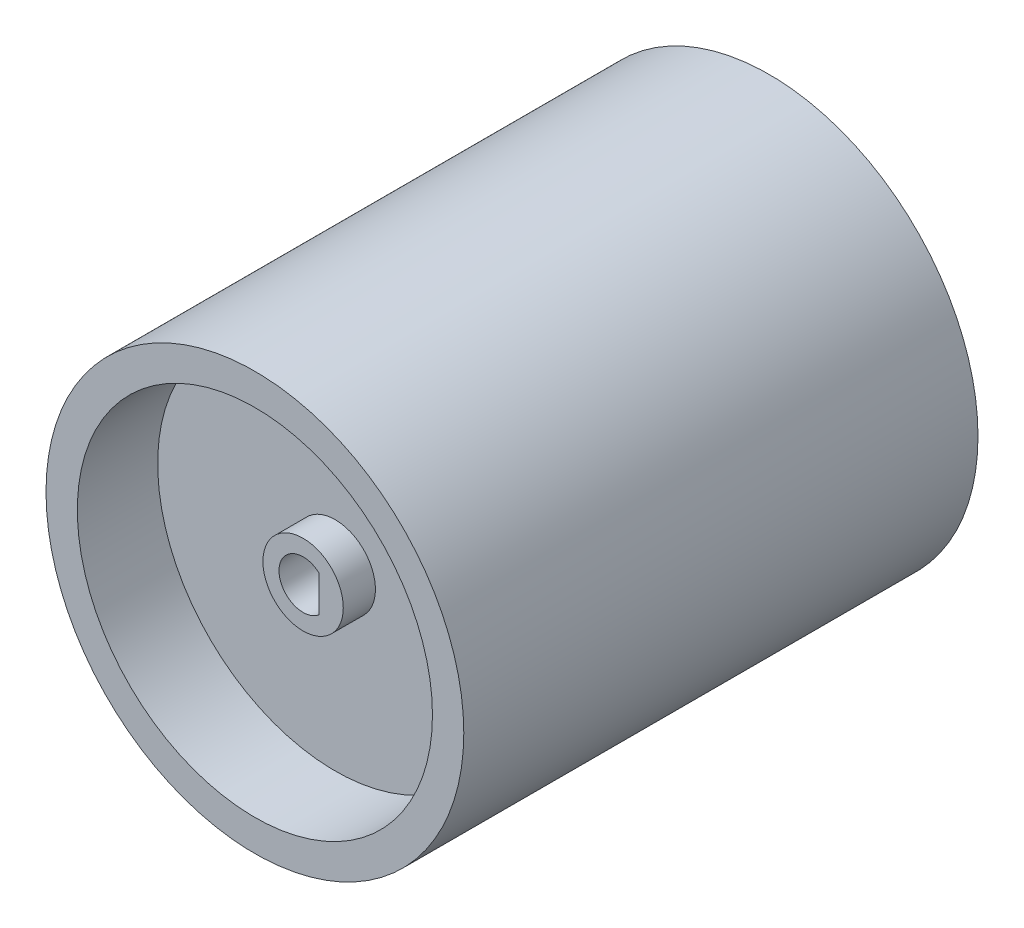
from build123d import *

# Parameters (mm, degrees)
SKETCH_1_R          = 13
SKETCH_1_R_2        = 11
EXTRUDE_1_DEPTH     = 7
SKETCH_3_R          = 13
EXTRUDE_2_DEPTH     = 2
CUT_EXTRUDE_1_REACH = 21.672
SKETCH_7_R          = 2.5
EXTRUDE_3_DEPTH     = 2
EXTRUDE_START       = 27
SKETCH_8_R          = 13
SKETCH_8_R_2        = 11
EXTRUDE_4_DEPTH     = 27
SKETCH_10_R         = 11.05
CUT_EXTRUDE_2_DEPTH = 27
CUT_EXTRUDE_START   = -5
SKETCH_11_R         = 11.05
SKETCH_11_R_2       = 2.5
CUT_EXTRUDE_3_DEPTH = 5
SKETCH_12_R         = 14.847927408
CUT_EXTRUDE_4_DEPTH = 2


with BuildPart() as part:
    # 草图1 → 凸台-拉伸1 (new body)
    with BuildSketch(Plane.XY):
        Circle(SKETCH_1_R)
        Circle(SKETCH_1_R_2, mode=Mode.SUBTRACT)
    extrude(amount=EXTRUDE_1_DEPTH)

    # 草图3 → 凸台-拉伸2 (add)
    with BuildSketch(Plane(origin=(0, 0, 0), x_dir=(-1, 0, 0), z_dir=(0, 0, -1))):
        with Locations(Location((0, 0, 0), (0, 0, 180))):
            Circle(SKETCH_3_R)
    extrude(amount=-EXTRUDE_2_DEPTH)

    # 草图6 → 切除-拉伸1 (cut, up to next)
    with BuildSketch(Plane(origin=(0, 0, 0), x_dir=(-1, 0, 0), z_dir=(0, 0, -1)), mode=Mode.PRIVATE) as cut_extrude_1_sk1:
        with BuildLine():
            Line((-1, -1.118033989), (-1, 1.118033989))
            ThreePointArc((-1, 1.118033989), (1.5, 0), (-1, -1.118033989))
        make_face()
    cut_extrude_1_tool1 = extrude(cut_extrude_1_sk1.sketch, amount=-CUT_EXTRUDE_1_REACH, mode=Mode.PRIVATE) & part.part
    add(cut_extrude_1_tool1.solids().sort_by_distance((-0.148024, 0, 0))[0], mode=Mode.SUBTRACT)

    # 草图7 → 凸台-拉伸3 (add)
    with BuildSketch(Plane.XY.offset(2)):
        with Locations(Location((0, 0, 0), (0, 0, 180))):
            Circle(SKETCH_7_R)
        with BuildLine():
            Line((1, -1.118033989), (1, 1.118033989))
            ThreePointArc((1, 1.118033989), (-1.5, 0), (1, -1.118033989))
        make_face(mode=Mode.SUBTRACT)
    extrude(amount=EXTRUDE_3_DEPTH)

    # 草图8 → 凸台-拉伸4 (add)
    with BuildSketch(Plane(origin=(0, 0, 0), x_dir=(-1, 0, 0), z_dir=(0, 0, -1)).offset(EXTRUDE_START)):
        Circle(SKETCH_8_R)
        Circle(SKETCH_8_R_2, mode=Mode.SUBTRACT)
    extrude(amount=-EXTRUDE_4_DEPTH)

    # 草图10 → 切除-拉伸2 (cut)
    with BuildSketch(Plane(origin=(0, 0, -27), x_dir=(-1, 0, 0), z_dir=(0, 0, -1))):
        Circle(SKETCH_10_R)
    extrude(amount=-CUT_EXTRUDE_2_DEPTH, mode=Mode.SUBTRACT)

    # 草图11 → 切除-拉伸3 (cut)
    with BuildSketch(Plane.XY.offset(7).offset(CUT_EXTRUDE_START)):
        with Locations(Location((0, 0, 0), (0, 0, 180))):
            Circle(SKETCH_11_R)
        with Locations(Location((0, 0, 0), (0, 0, 180))):
            Circle(SKETCH_11_R_2, mode=Mode.SUBTRACT)
    extrude(amount=CUT_EXTRUDE_3_DEPTH, mode=Mode.SUBTRACT)

    # 草图12 → 切除-拉伸4 (cut)
    with BuildSketch(Plane(origin=(0, 0, -27), x_dir=(-1, 0, 0), z_dir=(0, 0, -1))):
        Circle(SKETCH_12_R)
    extrude(amount=-CUT_EXTRUDE_4_DEPTH, mode=Mode.SUBTRACT)


solid = part.part
